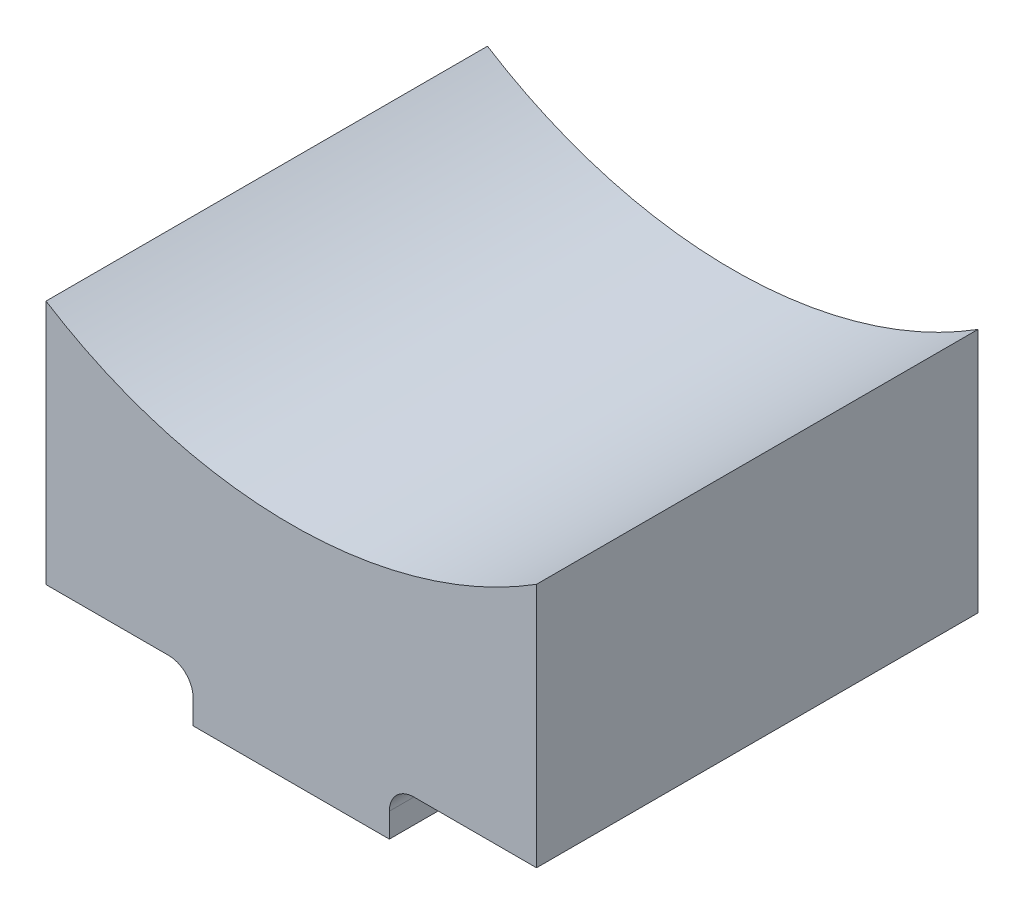
from build123d import *

# Parameters (mm, degrees)
BOSS_EXTRUDE1_DEPTH = 9


with BuildPart() as part:
    # Sketch1 → Boss-Extrude1 (new, symmetric)
    with BuildSketch(Plane.XY):
        with BuildLine():
            Line((10, 3.992849301), (10, -6.01853916))
            Line((10, -6.01853916), (5, -6.01853916))
            ThreePointArc((5, -6.01853916), (4.292893219, -6.311432379), (4, -7.01853916))
            Line((4, -7.01853916), (4, -8.007150699))
            Line((4, -8.007150699), (-4, -8.007150699))
            Line((-4, -8.007150699), (-4, -7.01853916))
            ThreePointArc((-4, -7.01853916), (-4.292893219, -6.311432379), (-5, -6.01853916))
            Line((-5, -6.01853916), (-10, -6.01853916))
            Line((-10, -6.01853916), (-10, 3.992849301))
            ThreePointArc((-10, 3.992849301), (0, 1.100511346), (10, 3.992849301))
        make_face()
    extrude(amount=BOSS_EXTRUDE1_DEPTH, both=True)


solid = part.part
